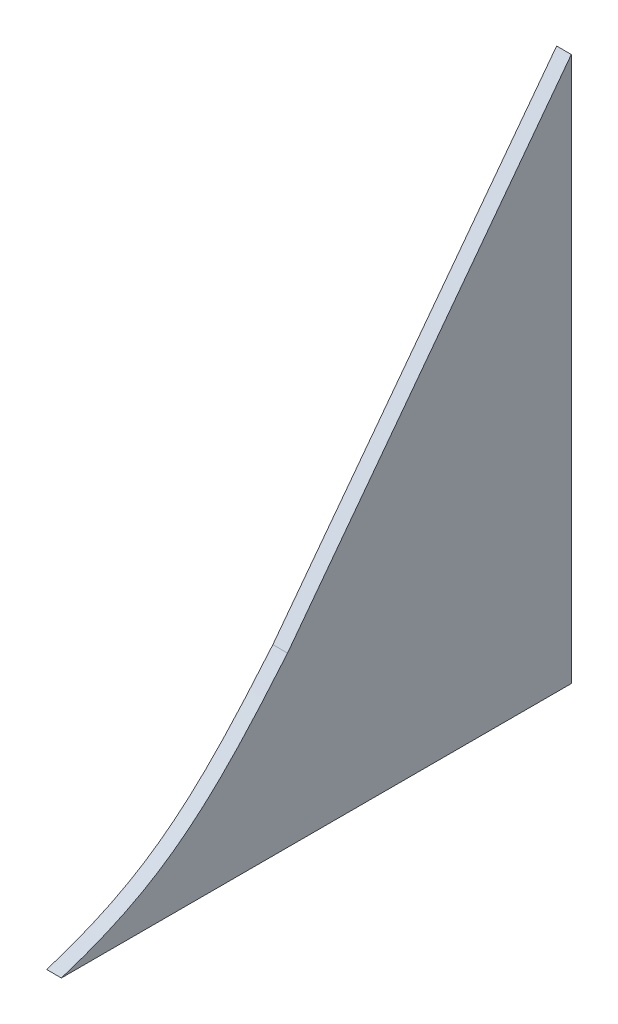
from build123d import *

# Parameters (mm, degrees)
BOSS_EXTRUDE1_DEPTH = 2.667


with BuildPart() as part:
    # Sketch1 → Boss-Extrude1 (new body)
    with BuildSketch(Plane(origin=(0, 0, 0), x_dir=(0, 0, -1), z_dir=(1, 0, 0))):
        with BuildLine():
            Line((-114.3, 99.06), (-114.3, 0))
            Line((-114.3, 0), (-207.01, 0))
            add(Edge.make_bspline(
                [(-165.89059286, 30.596970901), (-180.095244782, 13.619718651), (-188.62697832, 5.80175639), (-207.01, 0)],
                knots=[0, 0, 0, 0, 1, 1, 1, 1], degree=3))
            Line((-165.89059286, 30.596970901), (-114.3, 99.06))
        make_face()
    extrude(amount=BOSS_EXTRUDE1_DEPTH)


solid = part.part
